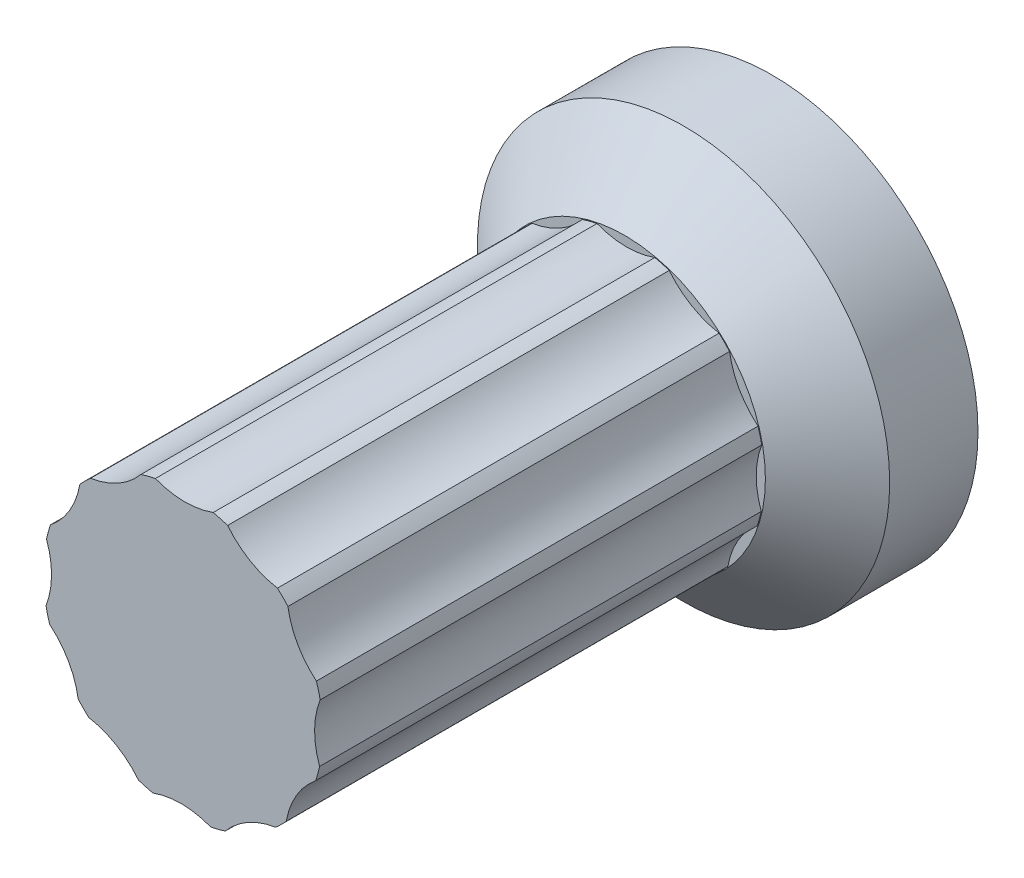
from build123d import *

# Parameters (mm, degrees)
CROQUIS1_R              = 7
SALIENTE_EXTRUIR1_DEPTH = 5
CROQUIS2_R              = 4.75
SALIENTE_EXTRUIR2_DEPTH = 15
CHAFL_N1_SIZE           = 2
CHAFL_N1_SIZE2          = 2.22122503
CORTAR_EXTRUIR1_START   = -15
CORTAR_EXTRUIR1_DEPTH   = 15
MATRIZC1_COUNT          = 12


with BuildPart() as part:
    # Croquis1 → Saliente-Extruir1 (new body)
    with BuildSketch(Plane.XY):
        Circle(CROQUIS1_R)
    extrude(amount=SALIENTE_EXTRUIR1_DEPTH)

    # Croquis2 → Saliente-Extruir2 (add)
    with BuildSketch(Plane.XY.offset(5)):
        Circle(CROQUIS2_R)
    extrude(amount=SALIENTE_EXTRUIR2_DEPTH)

    # Chaflán1
    chafl_n1_edges = [part.edges().sort_by_distance(p)[0] for p in [
        (-7, 0, 5),
    ]]
    chafl_n1_side = [part.faces().sort_by_distance(p)[0] for p in [
        (-7, 0, 2.5),
    ]]
    chamfer(chafl_n1_edges, length=CHAFL_N1_SIZE, length2=CHAFL_N1_SIZE2, reference=chafl_n1_side[0])

    # Croquis3 → Cortar-Extruir1 (cut)
    with BuildSketch(Plane.XY.offset(20).offset(CORTAR_EXTRUIR1_START)):
        with BuildLine():
            ThreePointArc((-0.941424284, 4.655772795), (0.03975399, 4.467490129), (1.024127494, 4.638282319))
            ThreePointArc((1.024127494, 4.638282319), (0.042266233, 4.749811951), (-0.941424284, 4.655772795))
        make_face()
    cortar_extruir1 = extrude(amount=CORTAR_EXTRUIR1_DEPTH, mode=Mode.SUBTRACT)

    # MatrizC1: Cortar-Extruir1 ×12 about axis
    matrizc1_axis = Axis((0, 0, 0), (0, 0, 1))
    for i in range(1, MATRIZC1_COUNT):
        add(cortar_extruir1.rotate(matrizc1_axis, i * 360 / MATRIZC1_COUNT), mode=Mode.SUBTRACT)


solid = part.part
